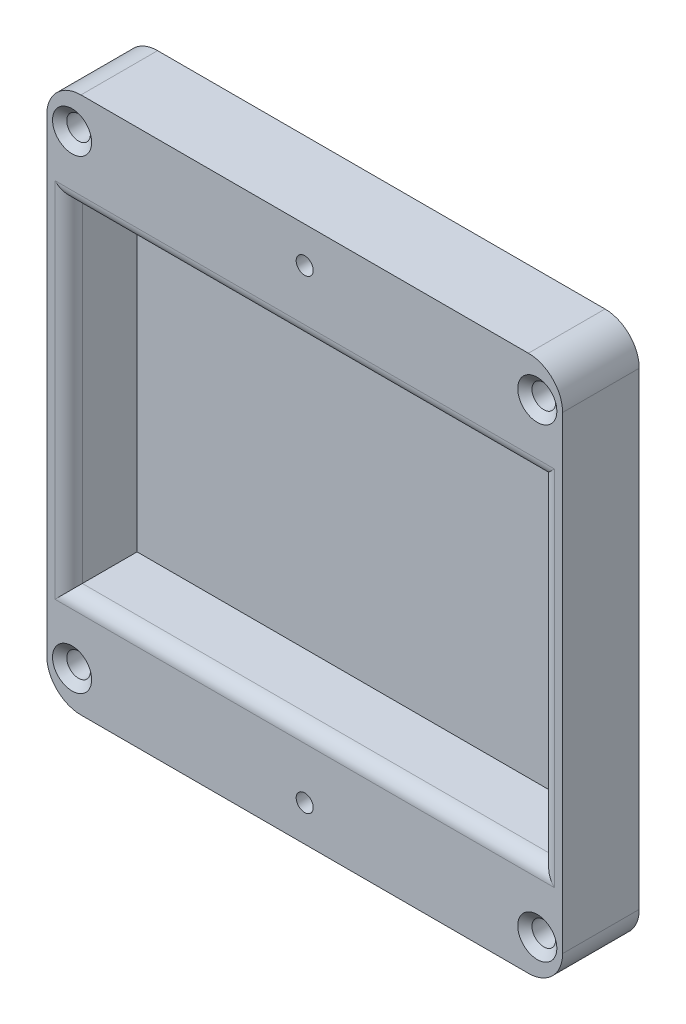
from build123d import *

# Parameters (mm, degrees)
SKETCH1_W                                         = 75.4
SKETCH1_H                                         = 78.5
BOSS_EXTRUDE1_DEPTH                               = 11.2
SKETCH2_W                                         = 69
SKETCH2_H                                         = 49
CUT_EXTRUDE1_DEPTH                                = 10
FILLET2_R                                         = 2
SKETCH3_R                                         = 1.2446
CUT_EXTRUDE2_DEPTH                                = 10
FILLET3_R                                         = 5
CSK_FOR_4_FLAT_HEAD_MACHINE_SCREW_100_D           = 3.4544
CSK_FOR_4_FLAT_HEAD_MACHINE_SCREW_100_CSINK_D     = 5.715
CSK_FOR_4_FLAT_HEAD_MACHINE_SCREW_100_CSINK_ANGLE = 100


with BuildPart() as part:
    # Sketch1 → Boss-Extrude1 (new body)
    with BuildSketch(Plane.XY):
        Rectangle(SKETCH1_W, SKETCH1_H)
    extrude(amount=BOSS_EXTRUDE1_DEPTH)

    # Sketch2 → Cut-Extrude1 (cut)
    with BuildSketch(Plane.XY.offset(11.2)):
        Rectangle(SKETCH2_W, SKETCH2_H)
    extrude(amount=-CUT_EXTRUDE1_DEPTH, mode=Mode.SUBTRACT)

    # Fillet2
    fillet2_edges = [part.edges().sort_by_distance(p)[0] for p in [
        (34.5, 0, 11.2),
        (0, 24.5, 11.2),
        (-34.5, 0, 11.2),
        (0, -24.5, 11.2),
    ]]
    fillet(fillet2_edges, radius=FILLET2_R)

    # Sketch3 → Cut-Extrude2 (cut)
    with BuildSketch(Plane.XY.offset(11.2)):
        with Locations((0, 34)):
            Circle(SKETCH3_R)
        with Locations(Location((0, -34, 0), (0, 0, 180))):
            Circle(SKETCH3_R)
    extrude(amount=-CUT_EXTRUDE2_DEPTH, mode=Mode.SUBTRACT)

    # Fillet3
    fillet3_edges = [part.edges().sort_by_distance(p)[0] for p in [
        (37.7, -39.25, 5.6),
        (-37.7, -39.25, 5.6),
        (-37.7, 39.25, 5.6),
        (37.7, 39.25, 5.6),
    ]]
    fillet(fillet3_edges, radius=FILLET3_R)

    # CSK for #4 Flat Head Machine Screw (100)1 (through all)
    with Locations(Plane.XY.offset(11.2)):
        with Locations((34, -34), (-34, -34), (-34, 34), (34, 34)):
            CounterSinkHole(CSK_FOR_4_FLAT_HEAD_MACHINE_SCREW_100_D / 2, CSK_FOR_4_FLAT_HEAD_MACHINE_SCREW_100_CSINK_D / 2, counter_sink_angle=CSK_FOR_4_FLAT_HEAD_MACHINE_SCREW_100_CSINK_ANGLE)


solid = part.part
